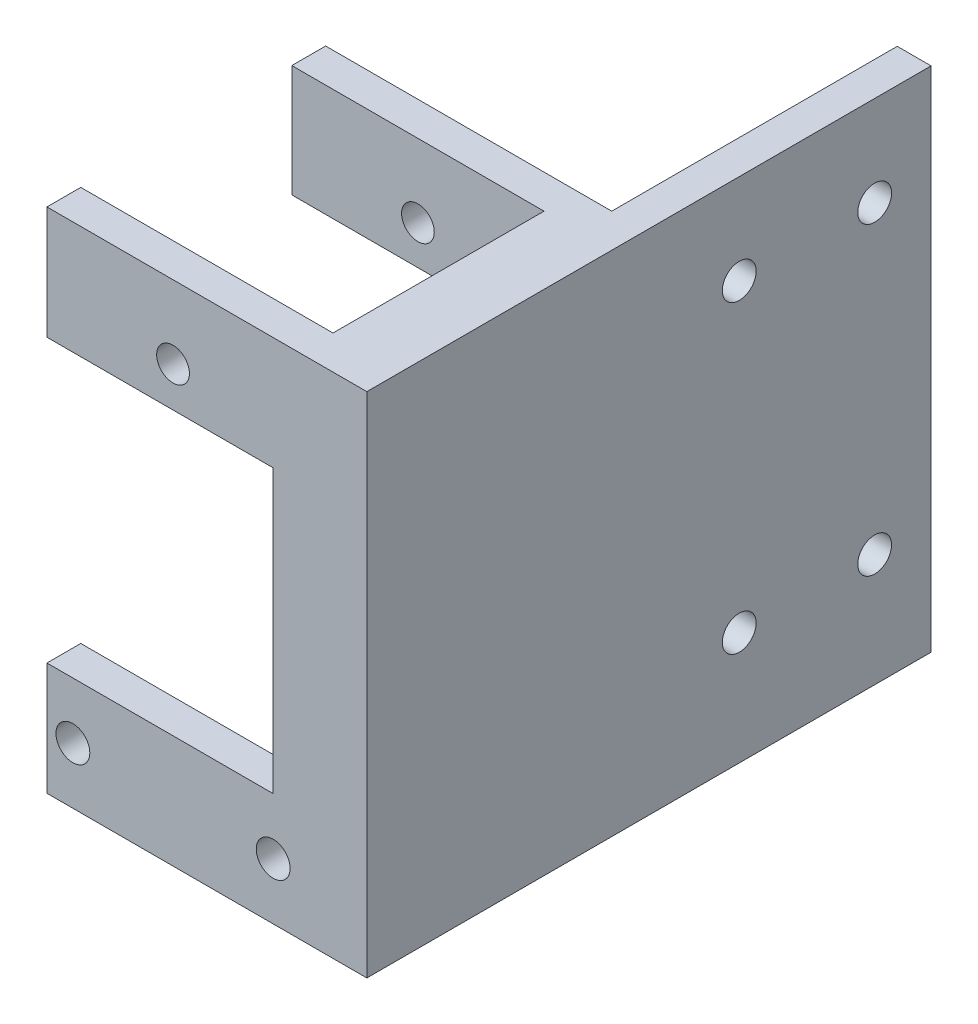
from build123d import *

# Parameters (mm, degrees)
SKETCH2_W           = 5.3
SKETCH2_H           = 25
SKETCH2_R           = 1.45
SKETCH2_R_2         = 1.5
BOSS_EXTRUDE1_DEPTH = 3
SKETCH3_W           = 50
SKETCH3_H           = 45
BOSS_EXTRUDE2_DEPTH = 3
SKETCH7_W           = 38.35
SKETCH7_H           = 3
BOSS_EXTRUDE3_DEPTH = 45
CUT_EXTRUDE1_DEPTH  = 5
SKETCH8_3_R         = 1.5
SKETCH8_3_R_2       = 1.45
CUT_EXTRUDE2_DEPTH  = 5
SKETCH11_R          = 1.5
CUT_EXTRUDE4_DEPTH  = 5
SKETCH12_W          = 18.7
SKETCH12_H          = 45
BOSS_EXTRUDE4_DEPTH = 3


with BuildPart() as part:
    # Sketch2 → Boss-Extrude1 (new body)
    # profile 1 of 3: a face of its own
    with BuildSketch(Plane.XY):
        with Locations((10.025, 0)):
            Rectangle(SKETCH2_W, SKETCH2_H)
    # profile 2 of 3: a face of its own
    with BuildSketch(Plane.XY):
        Polygon((7.375, 12.5), (12.675, 12.5), (12.675, 22.5), (-12.675, 22.5), (-12.675, 12.5), align=None)
        with Locations((-1.5, 16.025)):
            Circle(SKETCH2_R, mode=Mode.SUBTRACT)
    # profile 3 of 3: a face of its own
    with BuildSketch(Plane.XY):
        Polygon((-12.675, -22.5), (12.675, -22.5), (12.675, -12.5), (7.375, -12.5), (-12.675, -12.5), align=None)
        with Locations((-10.375, -17.5)):
            Circle(SKETCH2_R_2, mode=Mode.SUBTRACT)
        with Locations((7.375, -17.5)):
            Circle(SKETCH2_R_2, mode=Mode.SUBTRACT)
    extrude(amount=-BOSS_EXTRUDE1_DEPTH)

    # Sketch3 → Boss-Extrude2 (add)
    with BuildSketch(Plane(origin=(12.675, 0, 0), x_dir=(0, 0, -1), z_dir=(1, 0, 0))):
        with Locations((25, 0)):
            Rectangle(SKETCH3_W, SKETCH3_H)
    extrude(amount=BOSS_EXTRUDE2_DEPTH)

    # Sketch7 → Boss-Extrude3 (add)
    with BuildSketch(Plane(origin=(0, 22.5, 0), x_dir=(1, 0, 0), z_dir=(0, 1, 0))):
        with Locations((-3.5, 23.2)):
            Rectangle(SKETCH7_W, SKETCH7_H)
    extrude(amount=-BOSS_EXTRUDE3_DEPTH)

    # Sketch8 → Cut-Extrude1 (cut)
    with BuildSketch(Plane.XY.offset(-21.7)):
        Polygon((-12.675, 12.572802409), (-12.675, 22.5), (-22.675, 22.5), (-22.675, -22.5), (-12.675, -22.5), (-12.675, -12.5), (7.375, -12.5), (7.375, 12.572802409), align=None)
    extrude(amount=-CUT_EXTRUDE1_DEPTH, mode=Mode.SUBTRACT)

    # Sketch8<3> → Cut-Extrude2 (cut)
    with BuildSketch(Plane.XY.offset(-21.7)):
        with Locations((-10.375, -17.5)):
            Circle(SKETCH8_3_R)
        with Locations((7.375, -17.5)):
            Circle(SKETCH8_3_R)
        with Locations((-1.5, 16.025)):
            Circle(SKETCH8_3_R_2)
    extrude(amount=-CUT_EXTRUDE2_DEPTH, mode=Mode.SUBTRACT)

    # Sketch11 → Cut-Extrude4 (cut)
    with BuildSketch(Plane(origin=(15.675, 0, 0), x_dir=(0, 0, -1), z_dir=(1, 0, 0))):
        with Locations((33, 14.5)):
            Circle(SKETCH11_R)
        with Locations((45, 14.5)):
            Circle(SKETCH11_R)
        with Locations((33, -12.5)):
            Circle(SKETCH11_R)
        with Locations((45, -12.5)):
            Circle(SKETCH11_R)
    extrude(amount=-CUT_EXTRUDE4_DEPTH, mode=Mode.SUBTRACT)

    # Sketch12 → Boss-Extrude4 (add)
    with BuildSketch(Plane.ZY.offset(-12.675)):
        with Locations((-12.35, 0)):
            Rectangle(SKETCH12_W, SKETCH12_H)
    extrude(amount=BOSS_EXTRUDE4_DEPTH)


solid = part.part
